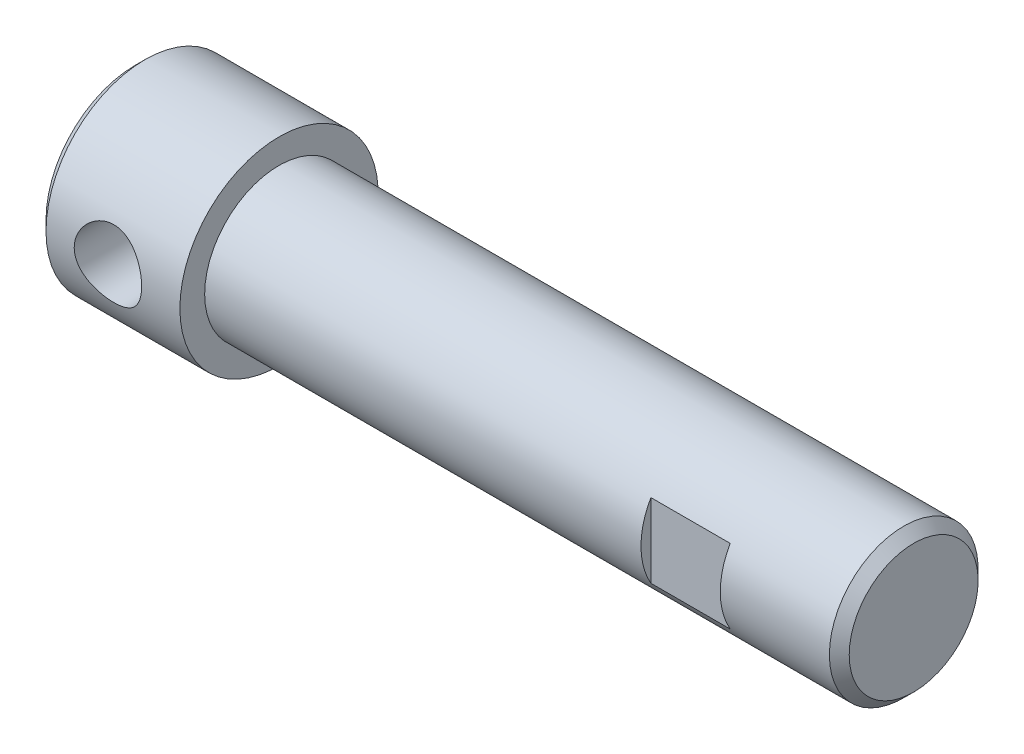
from build123d import *

# Parameters (mm, degrees)
CHANFREIN1_SIZE              = 1
TROU_TARAUD_M81_REACH        = 76.682
TROU_TARAUD_M81_BORE_R       = 3.4
ENL_V_MAT_EXTRU_1_DEPTH      = 66.543878463
ENL_V_MAT_EXTRU_1_DEPTH_BACK = 66.543878463
ESQUISSE4_W                  = 8
ESQUISSE4_H                  = 2.832418839


with BuildPart() as part:
    # Esquisse1 → Révolution1 (revolve)
    with BuildSketch(Plane.XY, mode=Mode.PRIVATE) as r_volution1_sk:
        Polygon((-14.5, 4), (-14.5, 10), (0, 10), (0, 7.5), (64, 7.5), (64, 0), (6.165063509, 0), (4, 3.75), (2, 3.75), (2, 4), align=None)
    revolve(r_volution1_sk.sketch.rotate(Axis((-22.202680924, 0, 0), (1, 0, 0)), 90), axis=Axis((-22.202680924, 0, 0), (1, 0, 0)))

    # Chanfrein1
    chanfrein1_edges = [part.edges().sort_by_distance(p)[0] for p in [
        (64, 0, -7.5),
        (-14.5, 0, -10),
    ]]
    chamfer(chanfrein1_edges, length=CHANFREIN1_SIZE)

    # Trou taraudé M81 bore (on position points) → Trou taraudé M81 (cut, up to next)
    with BuildSketch(Plane(origin=(-7.255410761, 0, 10), x_dir=(1, 0, 0), z_dir=(0, 0, 1)), mode=Mode.PRIVATE) as trou_taraud_m81_sk1:
        Circle(TROU_TARAUD_M81_BORE_R)
    trou_taraud_m81_tool1 = extrude(trou_taraud_m81_sk1.sketch, amount=-TROU_TARAUD_M81_REACH, mode=Mode.PRIVATE) & part.part
    add(trou_taraud_m81_tool1.solids().sort_by_distance((-7.255411, 0, 10))[0], mode=Mode.SUBTRACT)

    # Esquisse4 → Enlèv. mat.-Extru.1 (cut, two sides: drawn at the far end of the back side and taken through both)
    with BuildSketch(Plane(origin=(0, 0, 0), x_dir=(1, 0, 0), z_dir=(0, 1, 0)).offset(-ENL_V_MAT_EXTRU_1_DEPTH_BACK)):
        with Locations((48, -7.91620942)):
            Rectangle(ESQUISSE4_W, ESQUISSE4_H)
    extrude(amount=ENL_V_MAT_EXTRU_1_DEPTH + ENL_V_MAT_EXTRU_1_DEPTH_BACK, mode=Mode.SUBTRACT)


solid = part.part
